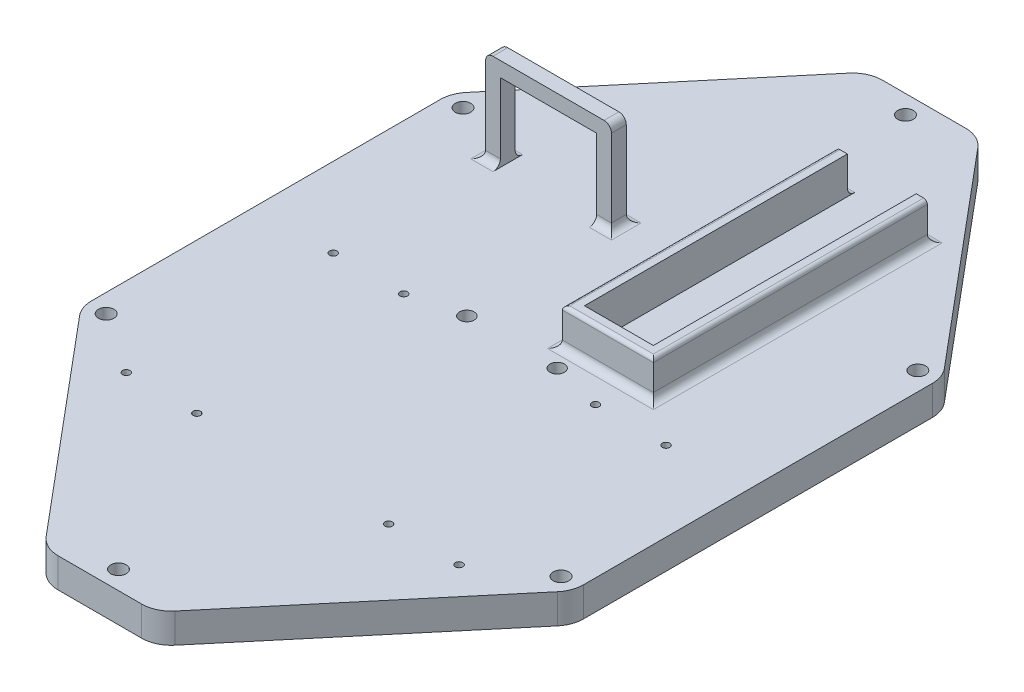
from build123d import *

# Parameters (mm, degrees)
BOSS_EXTRUDE2_DEPTH = 8
SKETCH5_R           = 2.1
CUT_EXTRUDE1_DEPTH  = 130.846239099
FILLET1_R           = 8
SKETCH6_R           = 1
CUT_EXTRUDE2_DEPTH  = 7
BOSS_EXTRUDE3_DEPTH = 10
FILLET2_R           = 2
SKETCH9_W           = 4
SKETCH9_H           = 4
BOSS_EXTRUDE4_DEPTH = 21
SKETCH10_W          = 34
SKETCH10_H          = 4
BOSS_EXTRUDE5_DEPTH = 4
FILLET3_R           = 2
FILLET4_R           = 1
SKETCH11_R          = 1.95
CUT_EXTRUDE3_DEPTH  = 132.988809405


with BuildPart() as part:
    # Sketch3 → Boss-Extrude2 (new body)
    with BuildSketch(Plane(origin=(0, 0, 0), x_dir=(1, 0, 0), z_dir=(0, 1, 0))):
        Polygon((-66.423008775, -50), (-66.423008775, 50), (-15, 111.28355545), (15, 111.28355545), (66.423008775, 50), (66.423008775, -50), (15, -111.28355545), (-15, -111.28355545), align=None)
    extrude(amount=BOSS_EXTRUDE2_DEPTH)

    # Sketch5 → Cut-Extrude1 (cut, through all)
    with BuildSketch(Plane(origin=(0, 8, 0), x_dir=(1, 0, 0), z_dir=(0, 1, 0))):
        with Locations(Location((0, -106.28355545, 0), (0, 0, 270))):
            Circle(SKETCH5_R)
        with Locations(Location((-61.423008775, -48.180148829, 0), (0, 0, 270))):
            Circle(SKETCH5_R)
        with Locations(Location((0, 106.28355545, 0), (0, 0, 90))):
            Circle(SKETCH5_R)
        with Locations(Location((-61.423008775, 48.180148829, 0), (0, 0, 90))):
            Circle(SKETCH5_R)
        with Locations(Location((61.423008775, 48.180148829, 0), (0, 0, 270))):
            Circle(SKETCH5_R)
        with Locations(Location((61.423008775, -48.180148829, 0), (0, 0, 90))):
            Circle(SKETCH5_R)
    extrude(amount=-CUT_EXTRUDE1_DEPTH, mode=Mode.SUBTRACT)

    # Fillet1
    fillet1_edges = [part.edges().sort_by_distance(p)[0] for p in [
        (-66.423008775, 4, 50),
        (-66.423008775, 4, -50),
        (-15, 4, -111.28355545),
        (15, 4, -111.28355545),
        (66.423008775, 4, -50),
        (66.423008775, 4, 50),
        (15, 4, 111.28355545),
        (-15, 4, 111.28355545),
    ]]
    fillet(fillet1_edges, radius=FILLET1_R)

    # Sketch6 → Cut-Extrude2 (cut)
    with BuildSketch(Plane(origin=(0, 8, 0), x_dir=(1, 0, 0), z_dir=(0, 1, 0))):
        with Locations(Location((-44.948008775, -3.34355545, 0), (0, 0, 270))):
            Circle(SKETCH6_R)
        with Locations(Location((-44.948008775, -59.22355545, 0), (0, 0, 270))):
            Circle(SKETCH6_R)
        with Locations(Location((-25.898008775, -59.22355545, 0), (0, 0, 90))):
            Circle(SKETCH6_R)
        with Locations(Location((-25.898008775, -3.34355545, 0), (0, 0, 90))):
            Circle(SKETCH6_R)
        with Locations(Location((44.948008775, -59.22355545, 0), (0, 0, 90))):
            Circle(SKETCH6_R)
        with Locations(Location((25.898008775, -59.22355545, 0), (0, 0, 270))):
            Circle(SKETCH6_R)
        with Locations(Location((44.948008775, -3.34355545, 0), (0, 0, 90))):
            Circle(SKETCH6_R)
        with Locations(Location((25.898008775, -3.34355545, 0), (0, 0, 270))):
            Circle(SKETCH6_R)
    extrude(amount=-CUT_EXTRUDE2_DEPTH, mode=Mode.SUBTRACT)

    # Sketch8 → Boss-Extrude3 (add)
    with BuildSketch(Plane(origin=(0, 8, 0), x_dir=(1, 0, 0), z_dir=(0, 1, 0))):
        Polygon((8.295310149, 79.28355545), (11.295310149, 79.28355545), (11.295310149, 8.28355545), (29.895310149, 8.28355545), (29.895310149, 79.28355545), (32.895310149, 79.28355545), (32.895310149, 5.28355545), (8.295310149, 5.28355545), align=None)
    extrude(amount=BOSS_EXTRUDE3_DEPTH)

    # Fillet2
    fillet2_edges = [part.edges().sort_by_distance(p)[0] for p in [
        (8.295310149, 8, -42.28355545),
        (20.595310149, 8, -5.28355545),
        (32.895310149, 8, -42.28355545),
        (31.395310149, 8, -79.28355545),
        (9.795310149, 8, -79.28355545),
    ]]
    fillet(fillet2_edges, radius=FILLET2_R)

    # Sketch9 → Boss-Extrude4 (add)
    with BuildSketch(Plane(origin=(0, 8, 0), x_dir=(1, 0, 0), z_dir=(0, 1, 0))):
        with Locations((-44.423008775, 41.28355545)):
            Rectangle(SKETCH9_W, SKETCH9_H)
        with Locations((-14.423008775, 41.28355545)):
            Rectangle(SKETCH9_W, SKETCH9_H)
    extrude(amount=BOSS_EXTRUDE4_DEPTH)

    # Sketch10 → Boss-Extrude5 (add)
    with BuildSketch(Plane(origin=(0, 29, 0), x_dir=(1, 0, 0), z_dir=(0, 1, 0))):
        with Locations((-29.423008775, 41.28355545)):
            Rectangle(SKETCH10_W, SKETCH10_H)
    extrude(amount=BOSS_EXTRUDE5_DEPTH)

    # Fillet3
    fillet3_edges = [part.edges().sort_by_distance(p)[0] for p in [
        (-44.423008775, 8, -43.28355545),
        (-46.423008775, 8, -41.28355545),
        (-44.423008775, 8, -39.28355545),
        (-12.423008775, 8, -41.28355545),
        (-14.423008775, 8, -43.28355545),
        (-14.423008775, 8, -39.28355545),
        (-46.423008775, 33, -41.28355545),
        (-12.423008775, 33, -41.28355545),
    ]]
    fillet(fillet3_edges, radius=FILLET3_R)

    # Fillet4
    fillet4_edges = [part.edges().sort_by_distance(p)[0] for p in [
        (8.295310149, 18, -42.28355545),
        (20.595310149, 18, -5.28355545),
        (32.895310149, 18, -42.28355545),
    ]]
    fillet(fillet4_edges, radius=FILLET4_R)

    # Sketch11 → Cut-Extrude3 (cut, through all)
    with BuildSketch(Plane(origin=(0, 8, 0), x_dir=(1, 0, 0), z_dir=(0, 1, 0))):
        with Locations(Location((12.2, 0, 0), (0, 0, 270))):
            Circle(SKETCH11_R)
        with Locations(Location((-12.2, 0, 0), (0, 0, 270))):
            Circle(SKETCH11_R)
    extrude(amount=-CUT_EXTRUDE3_DEPTH, mode=Mode.SUBTRACT)


solid = part.part
